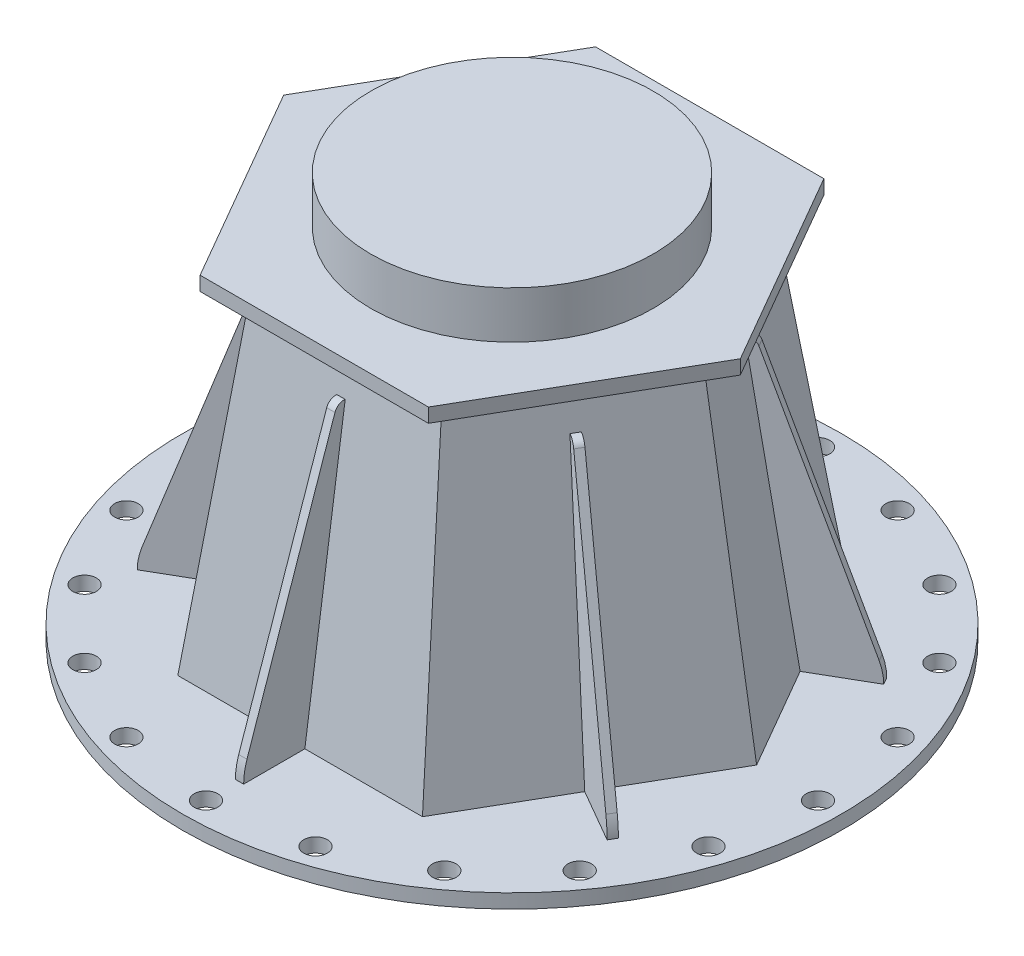
from build123d import *

# Parameters (mm, degrees)
SKETCH1_R           = 300
BOSS_EXTRUDE1_DEPTH = 100
BOSS_EXTRUDE2_DEPTH = 30
SKETCH11_R          = 700
BOSS_EXTRUDE4_DEPTH = 30
SKETCH12_R          = 25
CUT_EXTRUDE2_DEPTH  = 1292.859125447
CRVPATTERN2_COUNT   = 20
BOSS_EXTRUDE5_START = -7.5
BOSS_EXTRUDE5_DEPTH = 17.5
CIRPATTERN1_COUNT   = 6


with BuildPart() as part:
    # Sketch1 → Boss-Extrude1 (new body)
    with BuildSketch(Plane(origin=(0, 0, 0), x_dir=(1, 0, 0), z_dir=(0, 1, 0))):
        with Locations(Location((0, 0, 0), (0, 0, 270))):
            Circle(SKETCH1_R)
    extrude(amount=-BOSS_EXTRUDE1_DEPTH)


with BuildPart() as body_2:
    # Sketch2 → Boss-Extrude2 (new body)
    with BuildSketch(Plane.XZ.offset(100)):
        Polygon((484.974226119, 0), (242.48711306, 420), (-242.48711306, 420), (-484.974226119, 0), (-242.48711306, -420), (242.48711306, -420), align=None)
    extrude(amount=BOSS_EXTRUDE2_DEPTH)

    # Sketch5 → Loft2 section 0
    with BuildSketch(Plane(origin=(0, -130, 0), x_dir=(-1, 0, 0), z_dir=(0, -1, 0))):
        with BuildLine():
            Line((-404.145188433, 0), (-202.072594216, -350))
            Line((-202.072594216, -350), (202.072594216, -350))
            Line((202.072594216, -350), (404.145188433, 0))
            Line((404.145188433, 0), (202.072594216, 350))
            Line((202.072594216, 350), (-202.072594216, 350))
            Line((-202.072594216, 350), (-404.145188433, 0))
        make_face()
    # Sketch6 → Loft2 section 1
    with BuildSketch(Plane(origin=(0, -830, 0), x_dir=(-1, 0, 0), z_dir=(0, -1, 0))):
        with BuildLine():
            Line((-519.615242271, 0), (-259.807621135, -450))
            Line((-259.807621135, -450), (259.807621135, -450))
            Line((259.807621135, -450), (519.615242271, 0))
            Line((519.615242271, 0), (259.807621135, 450))
            Line((259.807621135, 450), (-259.807621135, 450))
            Line((-259.807621135, 450), (-519.615242271, 0))
        make_face()
    loft()

    # Sketch11 → Boss-Extrude4 (add)
    with BuildSketch(Plane(origin=(0, -830, 0), x_dir=(-1, 0, 0), z_dir=(0, -1, 0))):
        with Locations(Location((0, 0, 0), (0, 0, 90))):
            Circle(SKETCH11_R)
    extrude(amount=BOSS_EXTRUDE4_DEPTH)

    # Sketch12 → Cut-Extrude2 (cut, through all)
    with BuildSketch(Plane(origin=(0, -830, 0), x_dir=(-1, 0, 0), z_dir=(0, -1, 0))):
        with Locations(Location((650, 0, 0), (0, 0, 90))):
            Circle(SKETCH12_R)
    cut_extrude2 = extrude(amount=CUT_EXTRUDE2_DEPTH, mode=Mode.SUBTRACT)

    # CrvPattern2: Cut-Extrude2 ×20 about axis
    crvpattern2_axis = Axis((0, -830, 0), (0, -1, 0))
    for i in range(1, CRVPATTERN2_COUNT):
        add(cut_extrude2.rotate(crvpattern2_axis, i * 360 / CRVPATTERN2_COUNT), mode=Mode.SUBTRACT)

    # Sketch15 → Boss-Extrude5 (add)
    with BuildSketch(Plane(origin=(0, 0, 0), x_dir=(0, 0, -1), z_dir=(1, 0, 0)).offset(BOSS_EXTRUDE5_START)):
        with BuildLine():
            Line((-364.285714286, -230), (-450, -830))
            Line((-450, -830), (-580, -830))
            ThreePointArc((-580, -830), (-578.2268967, -808.602267345), (-572.955954419, -787.788233003))
            Line((-572.955954419, -787.788233003), (-386.03044209, -243.304871874))
            ThreePointArc((-386.03044209, -243.304871874), (-377.552523602, -232.739090189), (-364.285714286, -230))
        make_face()
    boss_extrude5 = extrude(amount=BOSS_EXTRUDE5_DEPTH)

    # CirPattern1: Boss-Extrude5 ×6 about axis
    cirpattern1_axis = Axis((0, 0, 0), (0, 1, 0))
    for i in range(1, CIRPATTERN1_COUNT):
        add(boss_extrude5.rotate(cirpattern1_axis, i * 360 / CIRPATTERN1_COUNT))


solid = Compound([part.part, body_2.part])
